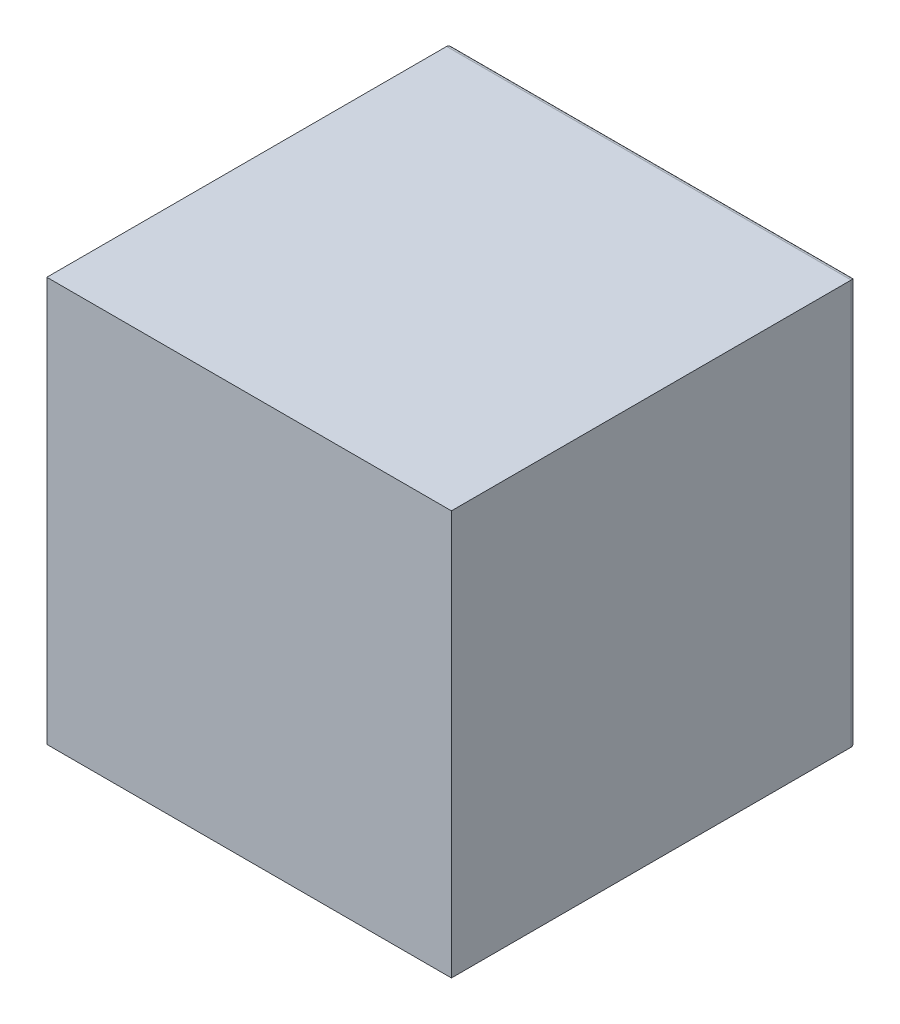
from build123d import *

# Parameters (mm, degrees)
SKETCH2_W           = 2500
SKETCH2_H           = 2500
BOSS_EXTRUDE1_DEPTH = 2500
SKETCH6_W           = 1500
SKETCH6_H           = 1500
CUT_EXTRUDE9_DEPTH  = 500
FILLET2_R           = 30


with BuildPart() as part:
    # Sketch2 → Boss-Extrude1 (new body)
    with BuildSketch(Plane(origin=(0, 0, 0), x_dir=(1, 0, 0), z_dir=(0, 1, 0))):
        with Locations((1250, -1250)):
            Rectangle(SKETCH2_W, SKETCH2_H)
    extrude(amount=BOSS_EXTRUDE1_DEPTH)

    # Sketch6 → Cut-Extrude9 (cut)
    with BuildSketch(Plane.XY):
        with Locations((1224.663925487, 1250)):
            Rectangle(SKETCH6_W, SKETCH6_H)
    extrude(amount=CUT_EXTRUDE9_DEPTH, mode=Mode.SUBTRACT)

    # Fillet2
    fillet2_edges = [part.edges().sort_by_distance(p)[0] for p in [
        (1250, 2500, 0),
        (1250, 0, 0),
        (0, 1250, 0),
        (2500, 1250, 0),
    ]]
    fillet(fillet2_edges, radius=FILLET2_R)


solid = part.part
